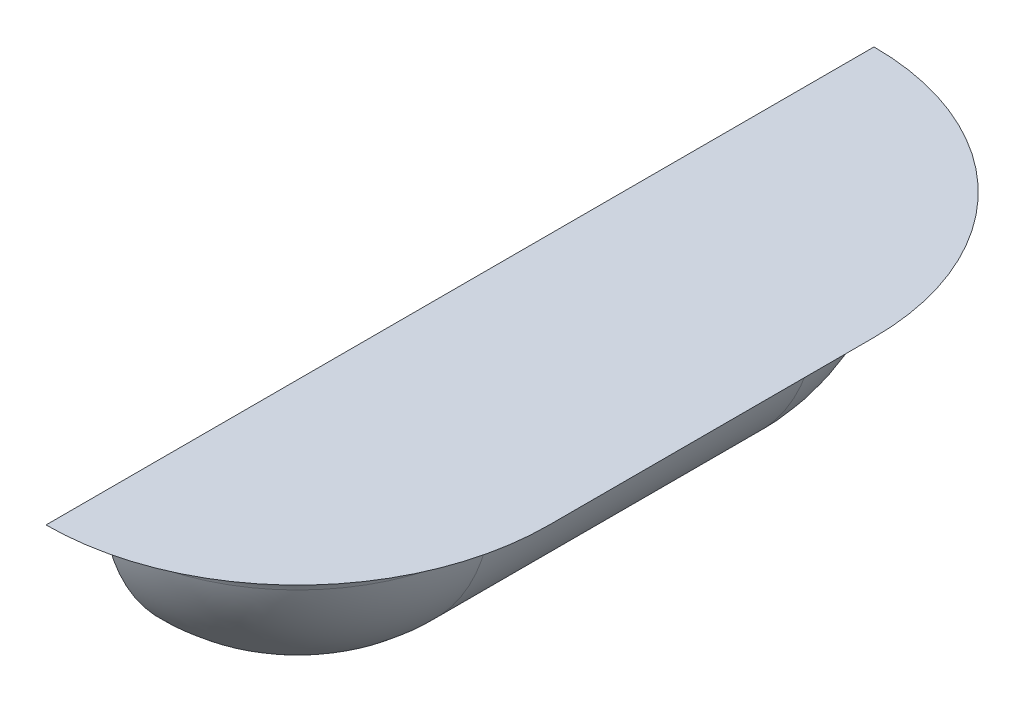
from build123d import *

# Parameters (mm, degrees)
SKETCH1_W           = 30
SKETCH1_H           = 3.464243611
BASE_EXTRUDE_DEPTH  = 25
BOSS_EXTRUDE1_DEPTH = 5
BOSS_REVOLVE2_ANGLE = 90
BOSS_REVOLVE3_ANGLE = 90
FILLET1_R           = 2
SKETCH8_W           = 50
SKETCH8_H           = 3.464243611
CUT_EXTRUDE4_DEPTH  = 40.509492685


with BuildPart() as part:
    # Sketch1 → Base-Extrude (new, symmetric)
    with BuildSketch(Plane.XY):
        with Locations((0, 1.732121806)):
            Rectangle(SKETCH1_W, SKETCH1_H)
    extrude(amount=BASE_EXTRUDE_DEPTH, both=True)

    # Louver Body → Boss-Extrude1 (add, symmetric)
    with BuildSketch(Plane.XY):
        with BuildLine():
            Line((-3, 0), (-3, -6))
            ThreePointArc((-3, -6), (1.242640687, -4.242640687), (3, 0))
            Line((3, 0), (-3, 0))
        make_face()
    extrude(amount=BOSS_EXTRUDE1_DEPTH, both=True)

    # Sketch12 → Boss-Revolve2 (revolve)
    with BuildSketch(Plane.XY.offset(5)):
        with BuildLine():
            Line((3, 0), (-3, 0))
            Line((-3, 0), (-3, -6))
            ThreePointArc((-3, -6), (1.242640687, -4.242640687), (3, 0))
        make_face()
    revolve(axis=Axis((-3, 0, 5), (0, -1, 0)), revolution_arc=BOSS_REVOLVE2_ANGLE)

    # Sketch13 → Boss-Revolve3 (revolve)
    with BuildSketch(Plane(origin=(0, 0, -5), x_dir=(-1, 0, 0), z_dir=(0, 0, -1))):
        with BuildLine():
            Line((3, 0), (-3, 0))
            ThreePointArc((-3, 0), (-1.242640687, -4.242640687), (3, -6))
            Line((3, -6), (3, 0))
        make_face()
    revolve(axis=Axis((-3, -6, -5), (0, 1, 0)), revolution_arc=BOSS_REVOLVE3_ANGLE)

    # Fillet1
    fillet1_edges = [part.edges().sort_by_distance(p)[0] for p in [
        (3, 0, 0),
        (1.242640687, 0, 9.242640687),
        (1.242640687, 0, -9.242640687),
    ]]
    fillet(fillet1_edges, radius=FILLET1_R)

    # Sketch8 → Cut-Extrude4 (cut, through all)
    with BuildSketch(Plane.ZY.offset(15)):
        with Locations((0, 1.732121806)):
            Rectangle(SKETCH8_W, SKETCH8_H)
    extrude(amount=-CUT_EXTRUDE4_DEPTH, mode=Mode.SUBTRACT)


solid = part.part
